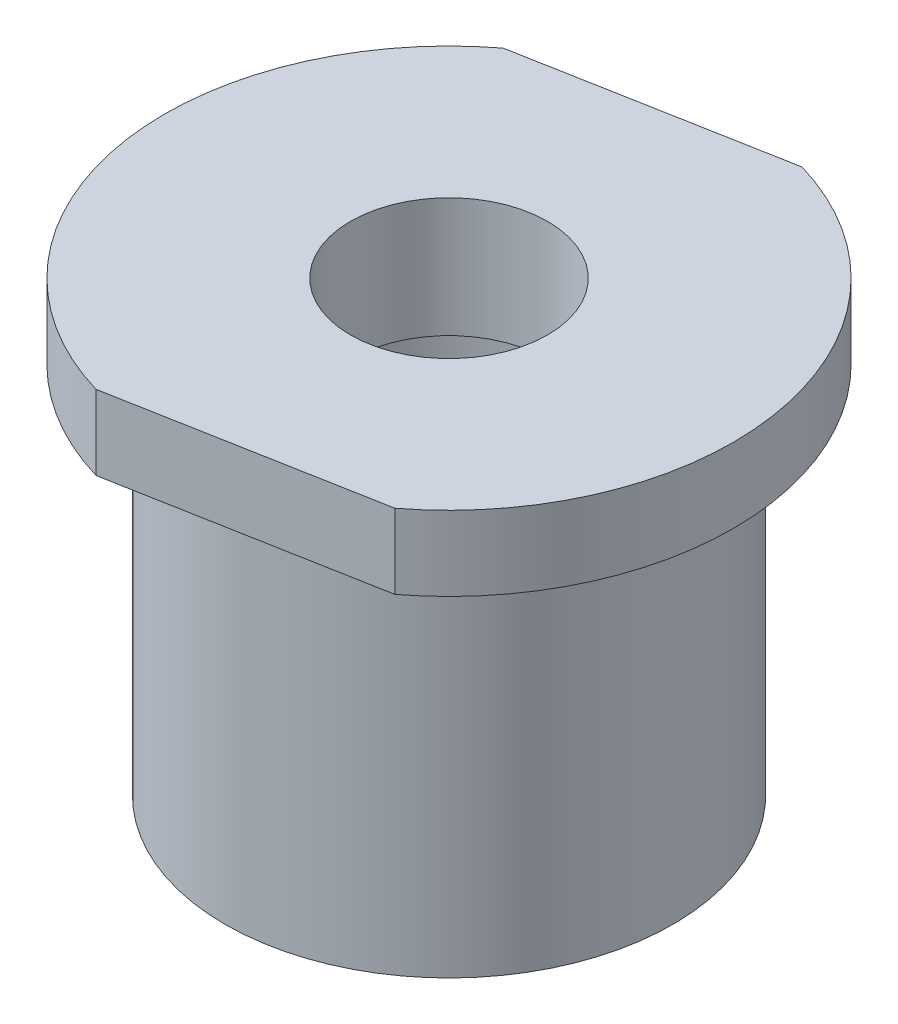
from build123d import *

# Parameters (mm, degrees)
SKETCH2_R          = 3.3
CUT_EXTRUDE1_DEPTH = 21.160636151
SKETCH3_R          = 5
CUT_EXTRUDE2_DEPTH = 11
CUT_EXTRUDE3_DEPTH = 21.160636151


with BuildPart() as part:
    # Sketch1 → Revolve1 (revolve)
    with BuildSketch(Plane.XY, mode=Mode.PRIVATE) as revolve1_sk:
        Polygon((0, 7.5), (-9.525, 7.5), (-9.525, 5), (-7.5, 5), (-7.5, -7.5), (0, -7.5), align=None)
    revolve(revolve1_sk.sketch.rotate(Axis((0, 7.5, 0), (0, -1, 0)), 270), axis=Axis((0, 7.5, 0), (0, -1, 0)))

    # Sketch2 → Cut-Extrude1 (cut, through all)
    with BuildSketch(Plane(origin=(0, 7.5, 0), x_dir=(1, 0, 0), z_dir=(0, 1, 0))):
        with Locations(Location((0, 0, 0), (0, 0, 270))):
            Circle(SKETCH2_R)
    extrude(amount=-CUT_EXTRUDE1_DEPTH, mode=Mode.SUBTRACT)

    # Sketch3 → Cut-Extrude2 (cut)
    with BuildSketch(Plane.XZ.offset(7.5)):
        with Locations(Location((0, 0, 0), (0, 0, 270))):
            Circle(SKETCH3_R)
    extrude(amount=-CUT_EXTRUDE2_DEPTH, mode=Mode.SUBTRACT)

    # Sketch4 → Cut-Extrude3 (cut, through all)
    with BuildSketch(Plane(origin=(0, 7.5, 0), x_dir=(1, 0, 0), z_dir=(0, 1, 0))):
        with BuildLine():
            Line((2.686807128, 9.138199629), (-5.767513864, 7.58033039))
            ThreePointArc((-5.767513864, 7.58033039), (-1.726101863, 9.367294025), (2.686807128, 9.138199629))
        make_face()
        with BuildLine():
            Line((5.767513864, -7.58033039), (-2.686807128, -9.138199629))
            ThreePointArc((-2.686807128, -9.138199629), (1.726101863, -9.367294025), (5.767513864, -7.58033039))
        make_face()
    extrude(amount=-CUT_EXTRUDE3_DEPTH, mode=Mode.SUBTRACT)


solid = part.part
